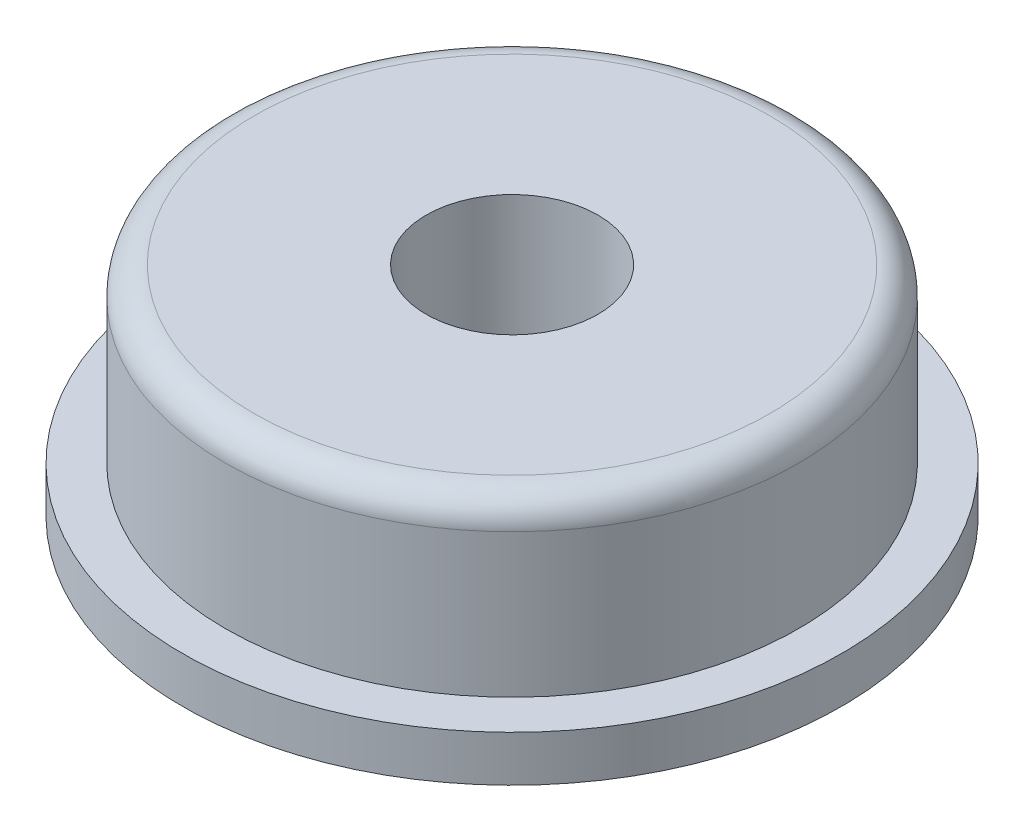
from build123d import *

# Parameters (mm, degrees)
SKETCH1_R           = 5.75
SKETCH1_R_2         = 1.5
BOSS_EXTRUDE1_DEPTH = 3.8
SKETCH2_OUTSIDE_W   = 16.84
SKETCH2_OUTSIDE_H   = 16.84
SKETCH2_OUTSIDE_R   = 5
CUT_EXTRUDE1_DEPTH  = 3
FILLET1_R           = 0.5


with BuildPart() as part:
    # Sketch1 → Boss-Extrude1 (new body)
    with BuildSketch(Plane(origin=(0, 0, 0), x_dir=(1, 0, 0), z_dir=(0, 1, 0))):
        with Locations(Location((0, 0, 0), (0, 0, 90))):
            Circle(SKETCH1_R)
        with Locations(Location((0, 0, 0), (0, 0, 90))):
            Circle(SKETCH1_R_2, mode=Mode.SUBTRACT)
    extrude(amount=BOSS_EXTRUDE1_DEPTH)

    # Sketch2 outside → Cut-Extrude1 (cut)
    with BuildSketch(Plane(origin=(0, 3.8, 0), x_dir=(1, 0, 0), z_dir=(0, 1, 0))):
        Rectangle(SKETCH2_OUTSIDE_W, SKETCH2_OUTSIDE_H)
        with Locations(Location((0, 0, 0), (0, 0, 270))):
            Circle(SKETCH2_OUTSIDE_R, mode=Mode.SUBTRACT)
    extrude(amount=-CUT_EXTRUDE1_DEPTH, mode=Mode.SUBTRACT)

    # Fillet1
    fillet1_edges = [part.edges().sort_by_distance(p)[0] for p in [
        (0, 3.8, -5),
    ]]
    fillet(fillet1_edges, radius=FILLET1_R)


solid = part.part
